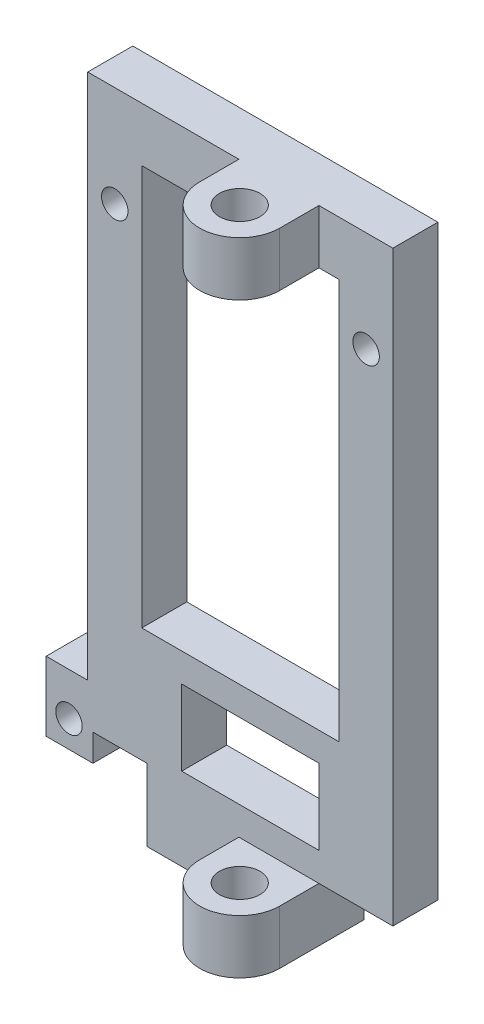
from build123d import *

# Parameters (mm, degrees)
SKETCH2_W               = 43.3
SKETCH2_H               = 71.19
SKETCH2_W_2             = 31.3
SKETCH2_H_2             = 59.19
BOSS_EXTRUDE1_DEPTH     = 5
SKETCH3_W               = 8.89
SKETCH3_H               = 6
BOSS_EXTRUDE2_DEPTH     = 8.8
CUT_EXTRUDE1_DEPTH      = 76.678124977
CUT_EXTRUDE1_DEPTH_BACK = 76.678124977
SKETCH5_R               = 2.2479
SKETCH8_W               = 11.205
SKETCH8_H               = 59.19
BOSS_EXTRUDE4_DEPTH     = 5
SKETCH9_W               = 9
SKETCH9_H               = 71.19
SKETCH9_W_2             = 2.21
SKETCH9_H_2             = 59.19
CUT_EXTRUDE2_DEPTH      = 5
SKETCH10_W              = 0.42
SKETCH10_H              = 59.19
BOSS_EXTRUDE5_DEPTH     = 5
SKETCH11_W              = 0.42
SKETCH11_H              = 71.19
CUT_EXTRUDE3_DEPTH      = 5
SKETCH12_W              = 6.655
SKETCH12_H              = 10.668
BOSS_EXTRUDE6_DEPTH     = 5
SKETCH13_W              = 8.205
SKETCH13_H              = 6
CUT_EXTRUDE4_DEPTH      = 5
SKETCH14_W              = 2
SKETCH14_H              = 10.668
CUT_EXTRUDE5_DEPTH      = 5
SKETCH15_W              = 5
SKETCH15_H              = 12.7
BOSS_EXTRUDE7_DEPTH     = 4.62
SKETCH16_W              = 10.785
SKETCH16_H              = 10.668
BOSS_EXTRUDE8_DEPTH     = 5
SKETCH17_W              = 6
SKETCH17_H              = 3
CUT_EXTRUDE6_DEPTH      = 5
SKETCH18_R              = 1.47
CUT_EXTRUDE7_DEPTH      = 5
SKETCH23_R              = 1.47
CUT_EXTRUDE10_DEPTH     = 5
SKETCH25_W              = 6.445
SKETCH25_H              = 2.583619091
BOSS_EXTRUDE12_DEPTH    = 5
SKETCH26_W              = 15.24
SKETCH26_H              = 8.382
SKETCH26_W_2            = 19.675
SKETCH26_H_2            = 6.066644496
SKETCH26_W_3            = 2.21
CUT_EXTRUDE11_DEPTH     = 5


with BuildPart() as part:
    # Sketch2 → Boss-Extrude1 (new body)
    with BuildSketch(Plane.XY):
        Rectangle(SKETCH2_W, SKETCH2_H)
        Rectangle(SKETCH2_W_2, SKETCH2_H_2, mode=Mode.SUBTRACT)
    extrude(amount=BOSS_EXTRUDE1_DEPTH)

    # Sketch3 → Boss-Extrude2 (add)
    with BuildSketch(Plane.XY.offset(5)):
        with Locations((0, 32.595)):
            Rectangle(SKETCH3_W, SKETCH3_H)
        with Locations((0, -32.595)):
            Rectangle(SKETCH3_W, SKETCH3_H)
    extrude(amount=BOSS_EXTRUDE2_DEPTH)

    # Sketch5 → Cut-Extrude1 (cut, two sides: drawn at the far end of the back side and taken through both)
    with BuildSketch(Plane(origin=(0, 35.595, 0), x_dir=(1, 0, 0), z_dir=(0, 1, 0)).offset(-CUT_EXTRUDE1_DEPTH_BACK)):
        with BuildLine():
            Line((-4.445, -13.8), (-2.8e-08, -13.8))
            ThreePointArc((-2.8e-08, -13.8), (-3.127220221, -12.513973022), (-4.445, -9.4))
            Line((-4.445, -9.4), (-4.445, -13.8))
        make_face()
        with BuildLine():
            Line((4.445, -13.8), (4.445, -9.4))
            ThreePointArc((4.445, -9.4), (3.127220202, -12.513973041), (-2.8e-08, -13.8))
            Line((-2.8e-08, -13.8), (4.445, -13.8))
        make_face()
        with Locations(Location((0, -9.354769886, 0), (0, 0, 90))):
            Circle(SKETCH5_R)
    extrude(amount=CUT_EXTRUDE1_DEPTH + CUT_EXTRUDE1_DEPTH_BACK, mode=Mode.SUBTRACT)

    # Sketch8 → Boss-Extrude4 (add)
    with BuildSketch(Plane.XY.offset(5)):
        with Locations((10.0475, 0)):
            Rectangle(SKETCH8_W, SKETCH8_H)
    extrude(amount=-BOSS_EXTRUDE4_DEPTH)

    # Sketch9 → Cut-Extrude2 (cut)
    with BuildSketch(Plane.XY.offset(5)):
        with Locations((17.15, 0)):
            Rectangle(SKETCH9_W, SKETCH9_H)
        with Locations((5.55, 0)):
            Rectangle(SKETCH9_W_2, SKETCH9_H_2)
    extrude(amount=-CUT_EXTRUDE2_DEPTH, mode=Mode.SUBTRACT)

    # Sketch10 → Boss-Extrude5 (add)
    with BuildSketch(Plane.XY.offset(5)):
        with Locations((-15.44, 0)):
            Rectangle(SKETCH10_W, SKETCH10_H)
    extrude(amount=-BOSS_EXTRUDE5_DEPTH)

    # Sketch11 → Cut-Extrude3 (cut)
    with BuildSketch(Plane.XY.offset(5)):
        with Locations((-21.44, 0)):
            Rectangle(SKETCH11_W, SKETCH11_H)
    extrude(amount=-CUT_EXTRUDE3_DEPTH, mode=Mode.SUBTRACT)

    # Sketch12 → Boss-Extrude6 (add)
    with BuildSketch(Plane.XY.offset(5)):
        with Locations((3.3275, -24.261)):
            Rectangle(SKETCH12_W, SKETCH12_H)
    extrude(amount=-BOSS_EXTRUDE6_DEPTH)

    # Sketch13 → Cut-Extrude4 (cut)
    with BuildSketch(Plane.XY.offset(5)):
        with Locations((8.5475, -32.595)):
            Rectangle(SKETCH13_W, SKETCH13_H)
    extrude(amount=-CUT_EXTRUDE4_DEPTH, mode=Mode.SUBTRACT)

    # Sketch14 → Cut-Extrude5 (cut)
    with BuildSketch(Plane.XY.offset(5)):
        with Locations((1, -24.261)):
            Rectangle(SKETCH14_W, SKETCH14_H)
    extrude(amount=-CUT_EXTRUDE5_DEPTH, mode=Mode.SUBTRACT)

    # Sketch15 → Boss-Extrude7 (add)
    with BuildSketch(Plane.ZY.offset(21.23)):
        with Locations((2.5, -29.245)):
            Rectangle(SKETCH15_W, SKETCH15_H)
    extrude(amount=BOSS_EXTRUDE7_DEPTH)

    # Sketch16 → Boss-Extrude8 (add)
    with BuildSketch(Plane.XY.offset(5)):
        with Locations((-9.8375, -24.261)):
            Rectangle(SKETCH16_W, SKETCH16_H)
    extrude(amount=-BOSS_EXTRUDE8_DEPTH)

    # Sketch17 → Cut-Extrude6 (cut)
    with BuildSketch(Plane.XY.offset(5)):
        with Locations((-17.65, -29.095)):
            Rectangle(SKETCH17_W, SKETCH17_H)
        Polygon((-25.85, -30.595), (-25.85, -35.595), (-14.65, -35.595), (-14.65, -30.595), (-20.65, -30.595), align=None)
    extrude(amount=-CUT_EXTRUDE6_DEPTH, mode=Mode.SUBTRACT)

    # Sketch18 → Cut-Extrude7 (cut)
    with BuildSketch(Plane.XY.offset(5)):
        with Locations((-23.31, -27.625)):
            Circle(SKETCH18_R)
    extrude(amount=-CUT_EXTRUDE7_DEPTH, mode=Mode.SUBTRACT)

    # Sketch23 → Cut-Extrude10 (cut)
    with BuildSketch(Plane.XY.offset(5)):
        with Locations((-18.23, 24.405)):
            Circle(SKETCH23_R)
        with Locations((9.68, 24.405)):
            Circle(SKETCH23_R)
    extrude(amount=-CUT_EXTRUDE10_DEPTH, mode=Mode.SUBTRACT)

    # Sketch25 → Boss-Extrude12 (add)
    with BuildSketch(Plane.XY.offset(5)):
        Polygon((6.655, -27.011380909), (6.655, -8.796355504), (-15.23, -8.796355504), (-15.23, -18.927), (-4.445, -18.927), (-4.445, -27.011380909), (2, -27.011380909), align=None)
        with Locations((-1.2225, -28.303190455)):
            Rectangle(SKETCH25_W, SKETCH25_H)
    extrude(amount=-BOSS_EXTRUDE12_DEPTH)

    # Sketch26 → Cut-Extrude11 (cut)
    with BuildSketch(Plane.XY.offset(5)):
        with Locations((-3.175, -22.229)):
            Rectangle(SKETCH26_W, SKETCH26_H)
        with Locations((-5.3925, -11.829677752)):
            Rectangle(SKETCH26_W_2, SKETCH26_H_2)
        with Locations((5.55, -11.829677752)):
            Rectangle(SKETCH26_W_3, SKETCH26_H_2)
    extrude(amount=-CUT_EXTRUDE11_DEPTH, mode=Mode.SUBTRACT)


solid = part.part
